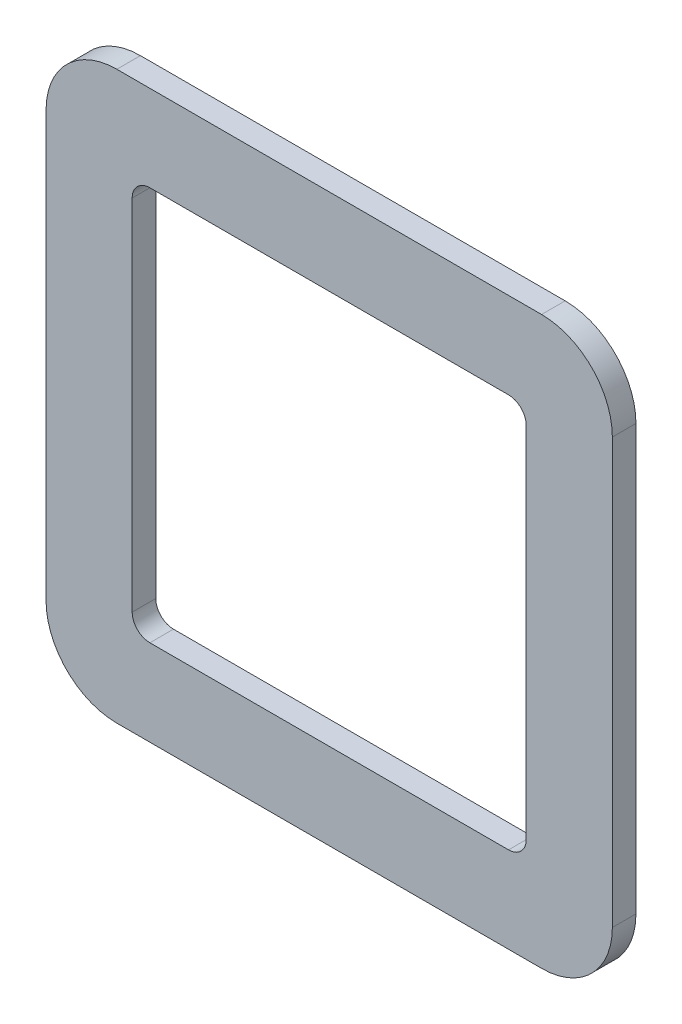
from build123d import *

# Parameters (mm, degrees)
BOSS_EXTRUDE1_DEPTH = 0.254
CIRPATTERN2_COUNT   = 4


with BuildPart() as part:
    # Sketch3 → Boss-Extrude1 (new, symmetric)
    with BuildSketch(Plane.XY):
        with BuildLine():
            Line((4.2418, 0.762), (6.096, 0.762))
            Line((6.096, 0.762), (6.096, 4.572))
            ThreePointArc((6.096, 4.572), (5.649630735, 5.649630735), (4.572, 6.096))
            Line((4.572, 6.096), (-0.889, 6.096))
            Line((-0.889, 6.096), (-0.889, 4.2418))
            Line((-0.889, 4.2418), (3.8608, 4.2418))
            ThreePointArc((3.8608, 4.2418), (4.130207684, 4.130207684), (4.2418, 3.8608))
            Line((4.2418, 3.8608), (4.2418, 0.762))
        make_face()
    boss_extrude1 = extrude(amount=BOSS_EXTRUDE1_DEPTH, both=True)

    # CirPattern2: Boss-Extrude1 ×4 about axis
    cirpattern2_axis = Axis((0, 0, -69.733664692), (0, 0, 1))
    for i in range(1, CIRPATTERN2_COUNT):
        add(boss_extrude1.rotate(cirpattern2_axis, i * 360 / CIRPATTERN2_COUNT))


solid = part.part
